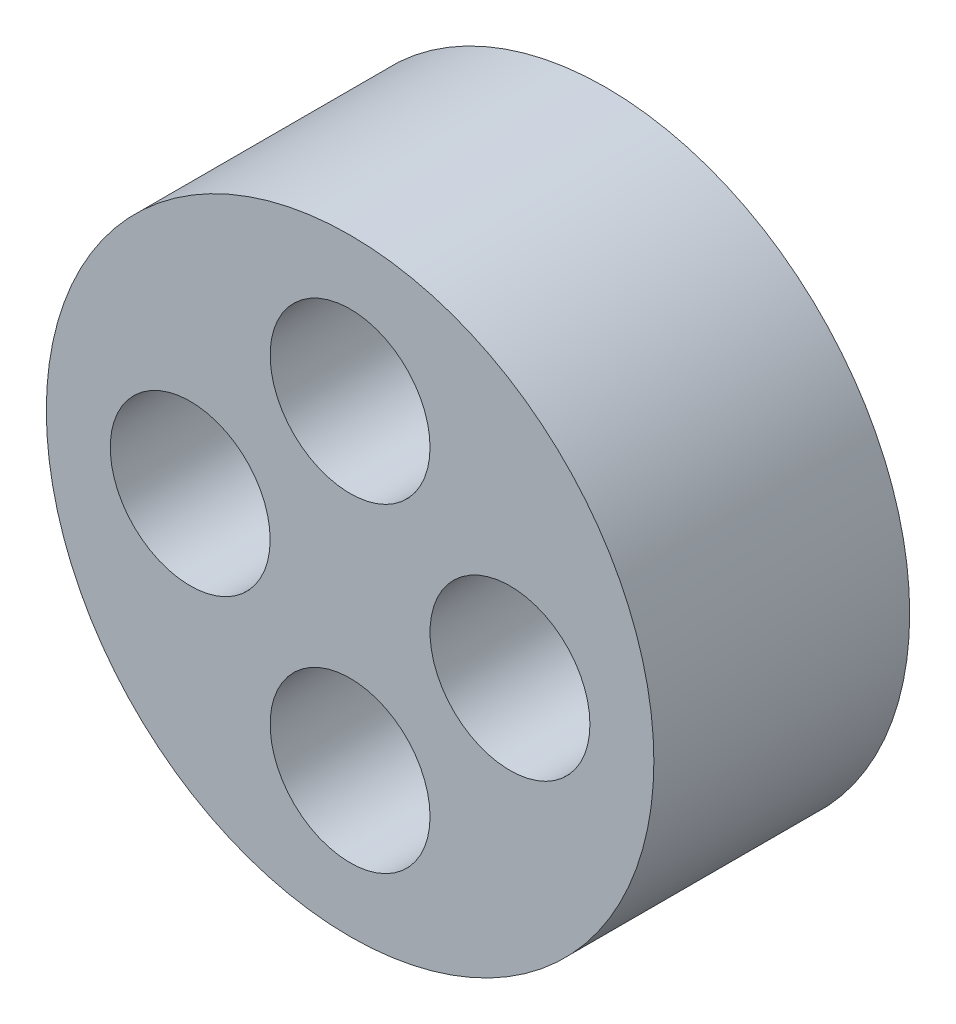
from build123d import *

# Parameters (mm, degrees)
CROQUIS1_R              = 4.75
SALIENTE_EXTRUIR1_DEPTH = 4


with BuildPart() as part:
    # Croquis1 → Saliente-Extruir1 (new body)
    # profile 1 of 2: a face of its own
    with BuildSketch(Plane.XY):
        Circle(CROQUIS1_R)
        with BuildLine():
            ThreePointArc((-2.1875, 1.210307296), (-1.767766953, 1.767766953), (-1.210307296, 2.1875))
            ThreePointArc((-1.210307296, 2.1875), (-0.157505366, 3.74003712), (1.25, 2.5))
            ThreePointArc((1.25, 2.5), (1.24003712, 2.342494634), (1.210307296, 2.1875))
            ThreePointArc((1.210307296, 2.1875), (1.767766953, 1.767766953), (2.1875, 1.210307296))
            ThreePointArc((2.1875, 1.210307296), (3.265465545, 0.988211769), (3.75, 0))
            ThreePointArc((3.75, 0), (3.265465545, -0.988211769), (2.1875, -1.210307296))
            ThreePointArc((2.1875, -1.210307296), (1.767766953, -1.767766953), (1.210307296, -2.1875))
            ThreePointArc((1.210307296, -2.1875), (1.24003712, -2.342494634), (1.25, -2.5))
            ThreePointArc((1.25, -2.5), (-0.157505366, -3.74003712), (-1.210307296, -2.1875))
            ThreePointArc((-1.210307296, -2.1875), (-1.767766953, -1.767766953), (-2.1875, -1.210307296))
            ThreePointArc((-2.1875, -1.210307296), (-3.75, 0), (-2.1875, 1.210307296))
        make_face(mode=Mode.SUBTRACT)
    # profile 2 of 2: a face of its own
    with BuildSketch(Plane.XY):
        with BuildLine():
            ThreePointArc((1.210307296, 2.1875), (0, 1.25), (-1.210307296, 2.1875))
            ThreePointArc((-1.210307296, 2.1875), (-1.767766953, 1.767766953), (-2.1875, 1.210307296))
            ThreePointArc((-2.1875, 1.210307296), (-1.511788231, 0.765465545), (-1.25, 0))
            ThreePointArc((-1.25, 0), (-1.511788231, -0.765465545), (-2.1875, -1.210307296))
            ThreePointArc((-2.1875, -1.210307296), (-1.767766953, -1.767766953), (-1.210307296, -2.1875))
            ThreePointArc((-1.210307296, -2.1875), (0, -1.25), (1.210307296, -2.1875))
            ThreePointArc((1.210307296, -2.1875), (1.767766953, -1.767766953), (2.1875, -1.210307296))
            ThreePointArc((2.1875, -1.210307296), (1.25, 0), (2.1875, 1.210307296))
            ThreePointArc((2.1875, 1.210307296), (1.767766953, 1.767766953), (1.210307296, 2.1875))
        make_face()
    extrude(amount=SALIENTE_EXTRUIR1_DEPTH)


solid = part.part
